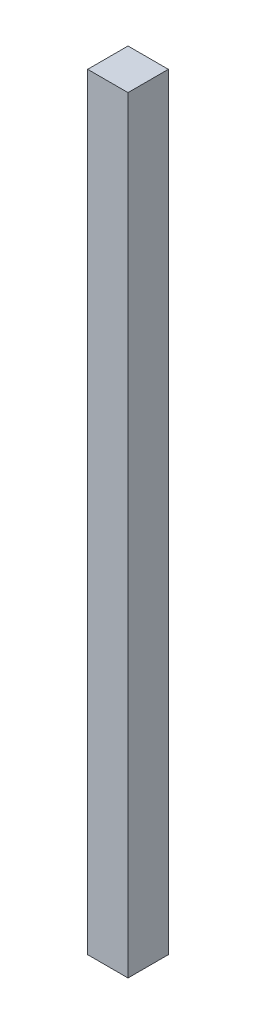
from build123d import *

# Parameters (mm, degrees)
SKETCH1_W           = 100
SKETCH1_H           = 100
BOSS_EXTRUDE1_DEPTH = 1900


with BuildPart() as part:
    # Sketch1 → Boss-Extrude1 (new body)
    with BuildSketch(Plane(origin=(0, 0, 0), x_dir=(1, 0, 0), z_dir=(0, 1, 0))):
        Rectangle(SKETCH1_W, SKETCH1_H)
    extrude(amount=BOSS_EXTRUDE1_DEPTH)


solid = part.part
